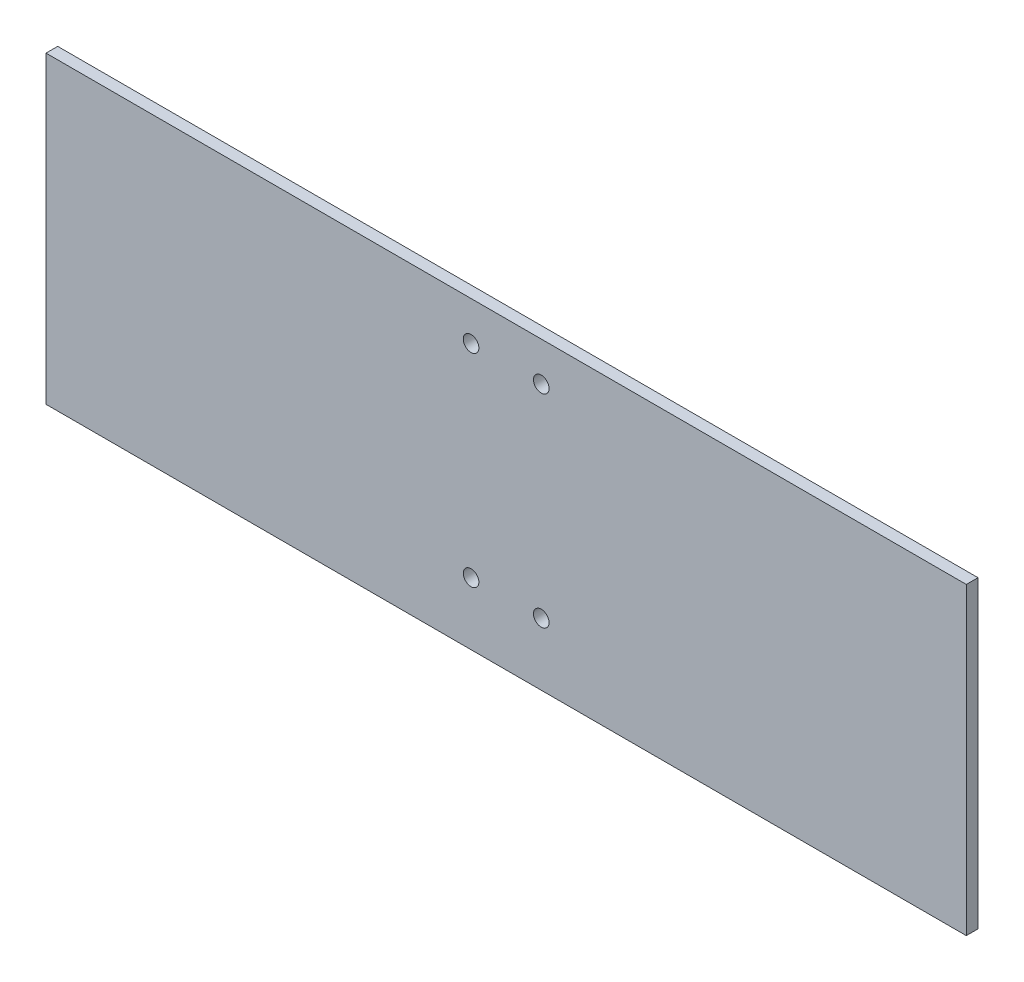
from build123d import *

# Parameters (mm, degrees)
ESQUISSE1_W             = 236
ESQUISSE1_H             = 72
BOSS_EXTRU_1_DEPTH      = 3
ENL_V_MAT_EXTRU_1_REACH = 126.314
ESQUISSE2_R             = 2
ESQUISSE3_W             = 236
ESQUISSE3_H             = 6
BOSS_EXTRU_2_DEPTH      = 3


with BuildPart() as part:
    # Esquisse1 → Boss.-Extru.1 (new body)
    with BuildSketch(Plane.XY):
        with Locations((0, -3)):
            Rectangle(ESQUISSE1_W, ESQUISSE1_H)
    extrude(amount=BOSS_EXTRU_1_DEPTH)

    # Esquisse2 → Enlèv. mat.-Extru.1 (cut, up to next)
    with BuildSketch(Plane.XY.offset(3), mode=Mode.PRIVATE) as enl_v_mat_extru_1_sk1:
        with Locations((9, -29)):
            Circle(ESQUISSE2_R)
    enl_v_mat_extru_1_tool1 = extrude(enl_v_mat_extru_1_sk1.sketch, amount=-ENL_V_MAT_EXTRU_1_REACH, mode=Mode.PRIVATE) & part.part
    # Esquisse2 → Enlèv. mat.-Extru.1 (cut, up to next)
    with BuildSketch(Plane.XY.offset(3), mode=Mode.PRIVATE) as enl_v_mat_extru_1_sk2:
        with Locations((-9, -29)):
            Circle(ESQUISSE2_R)
    enl_v_mat_extru_1_tool2 = extrude(enl_v_mat_extru_1_sk2.sketch, amount=-ENL_V_MAT_EXTRU_1_REACH, mode=Mode.PRIVATE) & part.part
    # Esquisse2 → Enlèv. mat.-Extru.1 (cut, up to next)
    with BuildSketch(Plane.XY.offset(3), mode=Mode.PRIVATE) as enl_v_mat_extru_1_sk3:
        with Locations((-9, 23)):
            Circle(ESQUISSE2_R)
    enl_v_mat_extru_1_tool3 = extrude(enl_v_mat_extru_1_sk3.sketch, amount=-ENL_V_MAT_EXTRU_1_REACH, mode=Mode.PRIVATE) & part.part
    # Esquisse2 → Enlèv. mat.-Extru.1 (cut, up to next)
    with BuildSketch(Plane.XY.offset(3), mode=Mode.PRIVATE) as enl_v_mat_extru_1_sk4:
        with Locations((9, 23)):
            Circle(ESQUISSE2_R)
    enl_v_mat_extru_1_tool4 = extrude(enl_v_mat_extru_1_sk4.sketch, amount=-ENL_V_MAT_EXTRU_1_REACH, mode=Mode.PRIVATE) & part.part
    add(enl_v_mat_extru_1_tool1.solids().sort_by_distance((9, -29, 3))[0], mode=Mode.SUBTRACT)
    add(enl_v_mat_extru_1_tool2.solids().sort_by_distance((-9, -29, 3))[0], mode=Mode.SUBTRACT)
    add(enl_v_mat_extru_1_tool3.solids().sort_by_distance((-9, 23, 3))[0], mode=Mode.SUBTRACT)
    add(enl_v_mat_extru_1_tool4.solids().sort_by_distance((9, 23, 3))[0], mode=Mode.SUBTRACT)

    # Esquisse3 → Boss.-Extru.2 (add)
    with BuildSketch(Plane.XY.offset(3)):
        with Locations((0, -42)):
            Rectangle(ESQUISSE3_W, ESQUISSE3_H)
    extrude(amount=-BOSS_EXTRU_2_DEPTH)


solid = part.part
